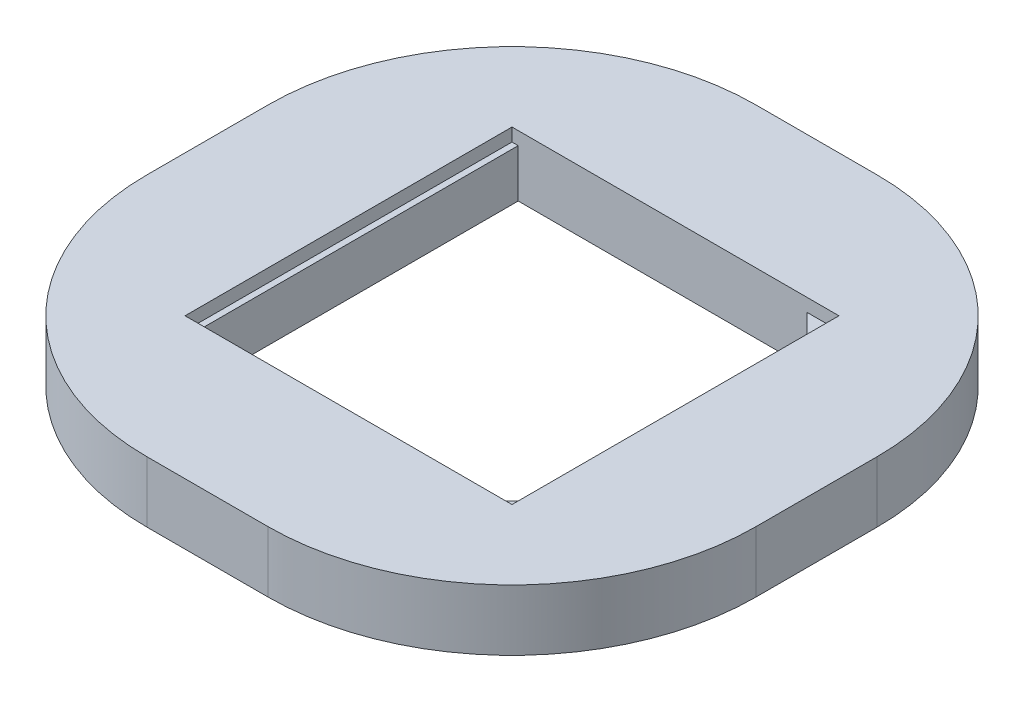
from build123d import *

# Parameters (mm, degrees)
SKETCH2_W          = 74.9
SKETCH2_H          = 74.9
BASE_DEPTH         = 7.5
SKETCH3_W          = 40.2
SKETCH3_H          = 40.2
SLOT_DEPTH         = 1.6
CUT_EXTRUDE2_DEPTH = 5.9
FILLET1_R          = 30


with BuildPart() as part:
    # Sketch2 → Base (new body)
    with BuildSketch(Plane(origin=(0, 0, 0), x_dir=(1, 0, 0), z_dir=(0, 1, 0))):
        Rectangle(SKETCH2_W, SKETCH2_H)
    extrude(amount=BASE_DEPTH)

    # Sketch3 → Slot (cut)
    with BuildSketch(Plane(origin=(0, 7.5, 0), x_dir=(1, 0, 0), z_dir=(0, 1, 0))):
        Rectangle(SKETCH3_W, SKETCH3_H)
    extrude(amount=-SLOT_DEPTH, mode=Mode.SUBTRACT)

    # Sketch4 → Cut-Extrude2 (cut)
    with BuildSketch(Plane(origin=(0, 5.9, 0), x_dir=(1, 0, 0), z_dir=(0, 1, 0))):
        Polygon((-19.336485636, -20.1), (-19.336485636, 20.1), (16.190707478, 20.1), (20.1, 16.190707478), (20.1, -16.190707478), (16.190707478, -20.1), align=None)
    extrude(amount=-CUT_EXTRUDE2_DEPTH, mode=Mode.SUBTRACT)

    # Fillet1
    fillet1_edges = [part.edges().sort_by_distance(p)[0] for p in [
        (37.45, 3.75, 37.45),
        (-37.45, 3.75, 37.45),
        (-37.45, 3.75, -37.45),
        (37.45, 3.75, -37.45),
    ]]
    fillet(fillet1_edges, radius=FILLET1_R)


solid = part.part
